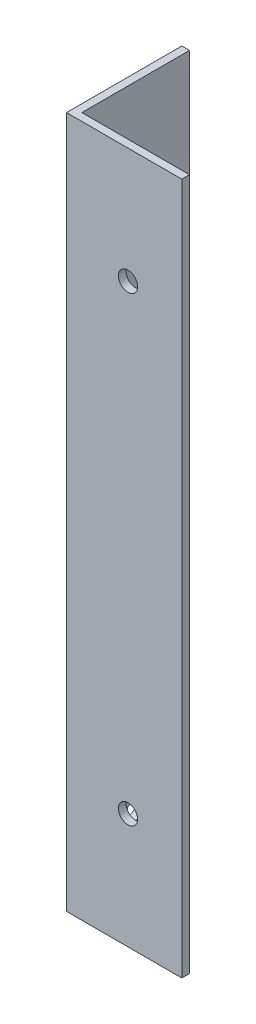
from build123d import *

# Parameters (mm, degrees)
SKETCH_1_W      = 15
SKETCH_1_H      = 1
EXTRUDE_1_DEPTH = 90
SKETCH_3_W      = 1
SKETCH_3_H      = 90
EXTRUDE_2_DEPTH = 14
M3X0_5_1_D      = 2.5
M3X0_5_2_D      = 2.5


with BuildPart() as part:
    # ｽｹｯﾁ1 → ﾎﾞｽ - 押し出し1 (new body)
    with BuildSketch(Plane(origin=(0, 0, 0), x_dir=(1, 0, 0), z_dir=(0, 1, 0))):
        with Locations((7.5, -0.5)):
            Rectangle(SKETCH_1_W, SKETCH_1_H)
    extrude(amount=EXTRUDE_1_DEPTH)

    # ｽｹｯﾁ3 → ﾎﾞｽ - 押し出し2 (add)
    with BuildSketch(Plane(origin=(0, 0, 0), x_dir=(-1, 0, 0), z_dir=(0, 0, -1))):
        with Locations((-0.5, 45)):
            Rectangle(SKETCH_3_W, SKETCH_3_H)
    extrude(amount=EXTRUDE_2_DEPTH)

    # M3x0.5 ねじ穴1 (through all)
    with Locations(Plane.XY.offset(1)):
        with Locations((8, 15), (8, 75)):
            Hole(M3X0_5_1_D / 2)

    # M3x0.5 ねじ穴2 (through all)
    with Locations(Plane.ZY):
        with Locations((-7, 8)):
            Hole(M3X0_5_2_D / 2)


solid = part.part
